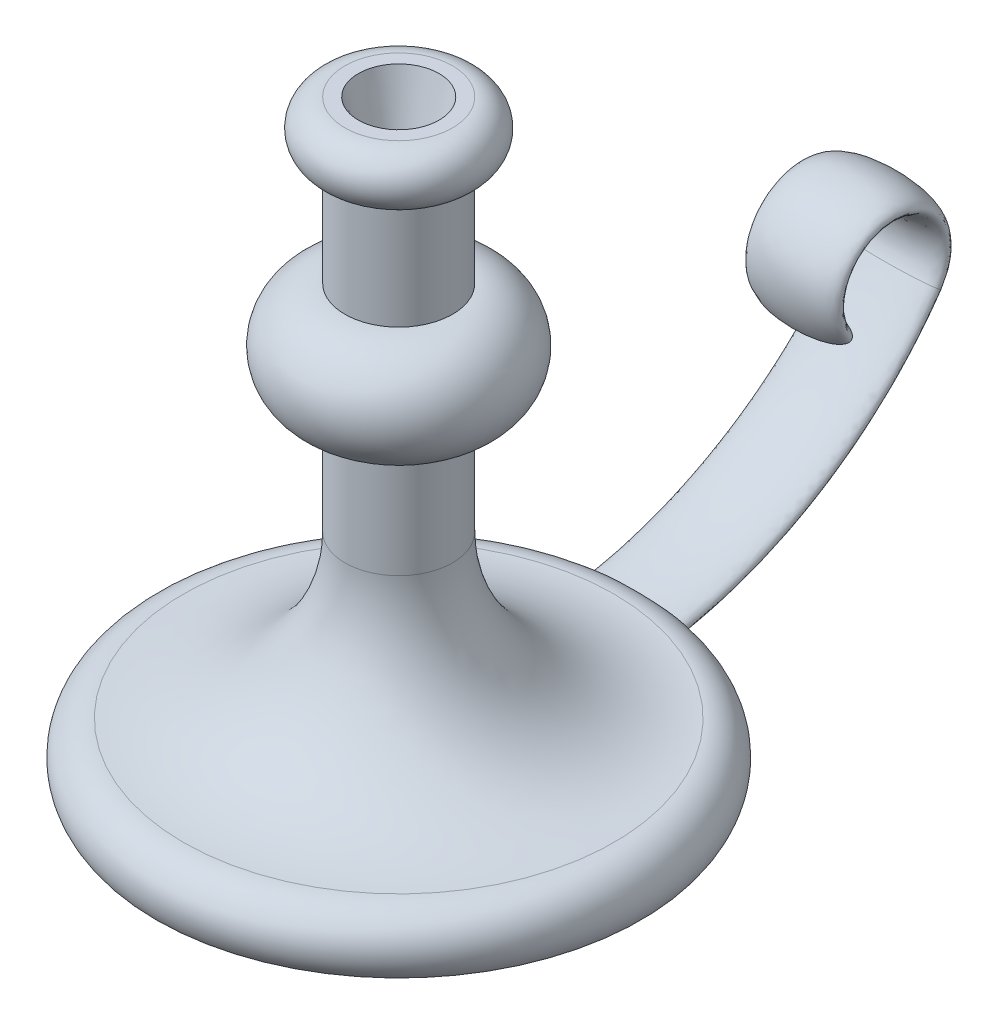
from build123d import *

# Parameters (mm, degrees)
SKETCH_4_RX         = 17.5
SKETCH_4_RY         = 5
SKETCH_8_R          = 15
CUT_EXTRUDE_1_DEPTH = 25
CUT_EXTRUDE_1_DRAFT = -15


with BuildPart() as part:
    # Эскиз1 → Повернуть1 (revolve)
    with BuildSketch(Plane.XY, mode=Mode.PRIVATE) as revolve_1_sk:
        with BuildLine():
            Line((90, 0), (0, 0))
            Line((0, 0), (0, 220))
            Line((0, 220), (20, 220))
            ThreePointArc((20, 220), (30, 210), (20, 200))
            Line((20, 200), (20, 160))
            ThreePointArc((20, 160), (40, 140), (20, 120))
            Line((20, 120), (20, 80))
            ThreePointArc((20, 80), (37.573593129, 37.573593129), (80, 20))
            ThreePointArc((80, 20), (91.180339887, 13.090169944), (90, 0))
        make_face()
    revolve(revolve_1_sk.sketch.rotate(Axis((0, 0, 0), (0, 1, 0)), 90), axis=Axis((0, 0, 0), (0, 1, 0)))

    # По траектории1: sweep along a path in Эскиз2
    with BuildLine(Plane(origin=(0, 0, 0), x_dir=(0, 0, -1), z_dir=(1, 0, 0))) as sweep_1_path:
        Line((0, 10), (60, 10))
        ThreePointArc((60, 10), (129.821200219, 27.240819526), (183.592070943, 75))
        ThreePointArc((183.592070943, 75), (167.113128151, 106.333333333), (150.634185358, 75))
    # Эскиз4 → По траектории1 (sweep)
    with BuildSketch(Plane.XY):
        with Locations(Location((0, 10), (0, 0, 180))):
            Ellipse(SKETCH_4_RX, SKETCH_4_RY)
    sweep(path=sweep_1_path.line)


with BuildPart() as cut_extrude_1_tool:
    # Эскиз8 → Вырез-Вытянуть1 (with draft: the straight prism first)
    with BuildSketch(Plane(origin=(0, 220, 0), x_dir=(1, 0, 0), z_dir=(0, 1, 0))):
        Circle(SKETCH_8_R)
    extrude(amount=-CUT_EXTRUDE_1_DEPTH)
    # Вырез-Вытянуть1: the draft: its side faces are tilted about the plane it starts from
    cut_extrude_1_sides = [cut_extrude_1_tool.faces().sort_by_distance(p)[0] for p in [
        (-15, 207.5, 0),
    ]]
    draft(cut_extrude_1_sides, Plane(origin=(0, 220, 0), x_dir=(1, 0, 0), z_dir=(0, 1, 0)), CUT_EXTRUDE_1_DRAFT)


with BuildPart() as part_1:
    add(part.part)

    # Вырез-Вытянуть1: cut by cut_extrude_1_tool
    add(cut_extrude_1_tool.part, mode=Mode.SUBTRACT)


solid = part_1.part
